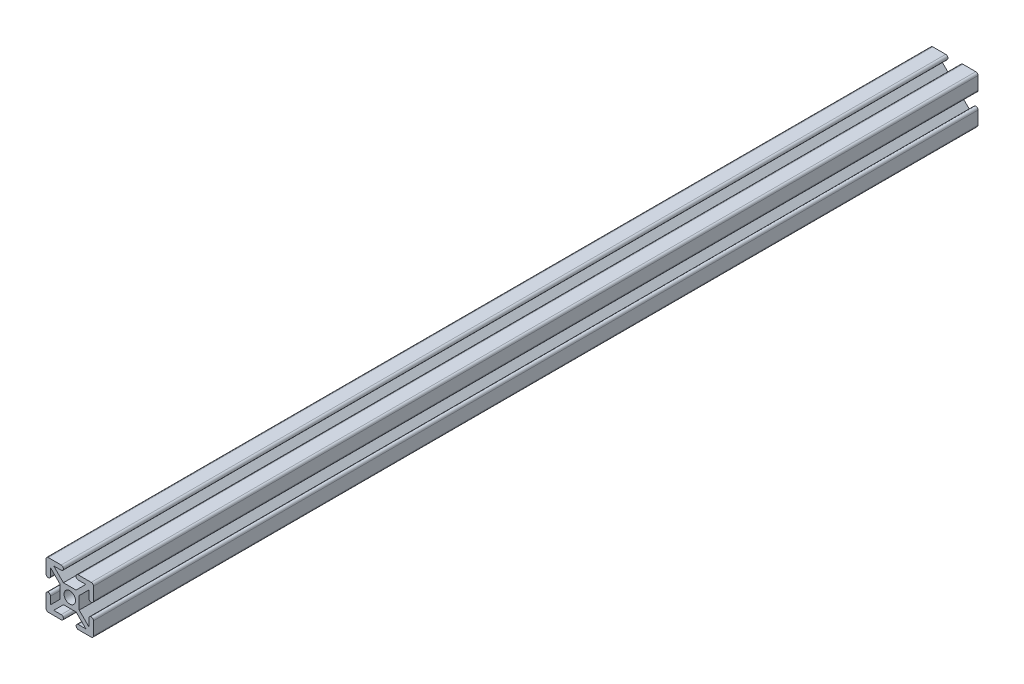
from build123d import *

# Parameters (mm, degrees)
CROQUIS1_R              = 3.645
SALIENTE_EXTRUIR1_DEPTH = 559.14


with BuildPart() as part:
    # Croquis1 → Saliente-Extruir1 (new body)
    with BuildSketch(Plane.XY):
        with BuildLine():
            Line((-2.128178406, 21.777166152), (2.596821594, 21.777166152))
            Line((2.596821594, 21.777166152), (-3.553178406, 27.927166152))
            Line((-3.553178406, 27.927166152), (-11.553178406, 27.927166152))
            Line((-11.553178406, 27.927166152), (-17.703178406, 21.777166152))
            Line((-17.703178406, 21.777166152), (-12.978178406, 21.777166152))
            ThreePointArc((-12.978178406, 21.777166152), (-11.553178406, 20.352166152), (-12.978178406, 18.927166152))
            Line((-12.978178406, 18.927166152), (-21.154614178, 18.953601925))
            ThreePointArc((-21.154614178, 18.953601925), (-22.143548427, 19.363231903), (-22.553178406, 20.352166152))
            Line((-22.553178406, 20.352166152), (-22.553178406, 28.502166152))
            ThreePointArc((-22.553178406, 28.502166152), (-21.154614178, 29.90073038), (-19.756049951, 28.502166152))
            Line((-19.756049951, 28.502166152), (-19.756049951, 23.777166152))
            Line((-19.756049951, 23.777166152), (-13.606049951, 29.927166152))
            Line((-13.606049951, 29.927166152), (-13.606049951, 37.927166152))
            Line((-13.606049951, 37.927166152), (-19.756049951, 44.077166152))
            Line((-19.756049951, 44.077166152), (-19.756049951, 39.352166152))
            ThreePointArc((-19.756049951, 39.352166152), (-21.181049951, 37.927166152), (-22.606049951, 39.352166152))
            Line((-22.606049951, 39.352166152), (-22.606049951, 47.502119562))
            ThreePointArc((-22.606049951, 47.502119562), (-22.188677114, 48.509746725), (-21.181049951, 48.927119562))
            Line((-21.181049951, 48.927119562), (-13.031049951, 48.927119562))
            ThreePointArc((-13.031049951, 48.927119562), (-11.606049951, 47.502119562), (-13.031049951, 46.077119562))
            Line((-13.031049951, 46.077119562), (-17.756049951, 46.077119562))
            Line((-17.756049951, 46.077119562), (-11.606049951, 39.927119562))
            Line((-11.606049951, 39.927119562), (-3.606049951, 39.927119562))
            Line((-3.606049951, 39.927119562), (2.543950049, 46.077119562))
            Line((2.543950049, 46.077119562), (-2.181049951, 46.077119562))
            ThreePointArc((-2.181049951, 46.077119562), (-3.606049951, 47.502119562), (-2.181049951, 48.927119562))
            Line((-2.181049951, 48.927119562), (5.968950049, 48.927119562))
            ThreePointArc((5.968950049, 48.927119562), (6.976577212, 48.509746725), (7.393950049, 47.502119562))
            Line((7.393950049, 47.502119562), (7.393950049, 39.455863248))
            ThreePointArc((7.393950049, 39.455863248), (5.968950049, 38.030863248), (4.543950049, 39.455863248))
            Line((4.543950049, 39.455863248), (4.543950049, 44.077119562))
            Line((4.543950049, 44.077119562), (-1.606049951, 37.927119562))
            Line((-1.606049951, 37.927119562), (-1.606049951, 29.927119562))
            Line((-1.606049951, 29.927119562), (4.543950049, 23.777119562))
            Line((4.543950049, 23.777119562), (4.543950049, 28.605863248))
            ThreePointArc((4.543950049, 28.605863248), (5.968950049, 30.030863248), (7.393950049, 28.605863248))
            Line((7.393950049, 28.605863248), (7.393950049, 20.352166152))
            ThreePointArc((7.393950049, 20.352166152), (6.976577212, 19.344538989), (5.968950049, 18.927166152))
            Line((5.968950049, 18.927166152), (-2.128178406, 18.927166152))
            ThreePointArc((-2.128178406, 18.927166152), (-3.553178406, 20.352166152), (-2.128178406, 21.777166152))
        make_face()
        with Locations((-7.553178406, 33.927166152)):
            Circle(CROQUIS1_R, mode=Mode.SUBTRACT)
    extrude(amount=SALIENTE_EXTRUIR1_DEPTH)


solid = part.part
